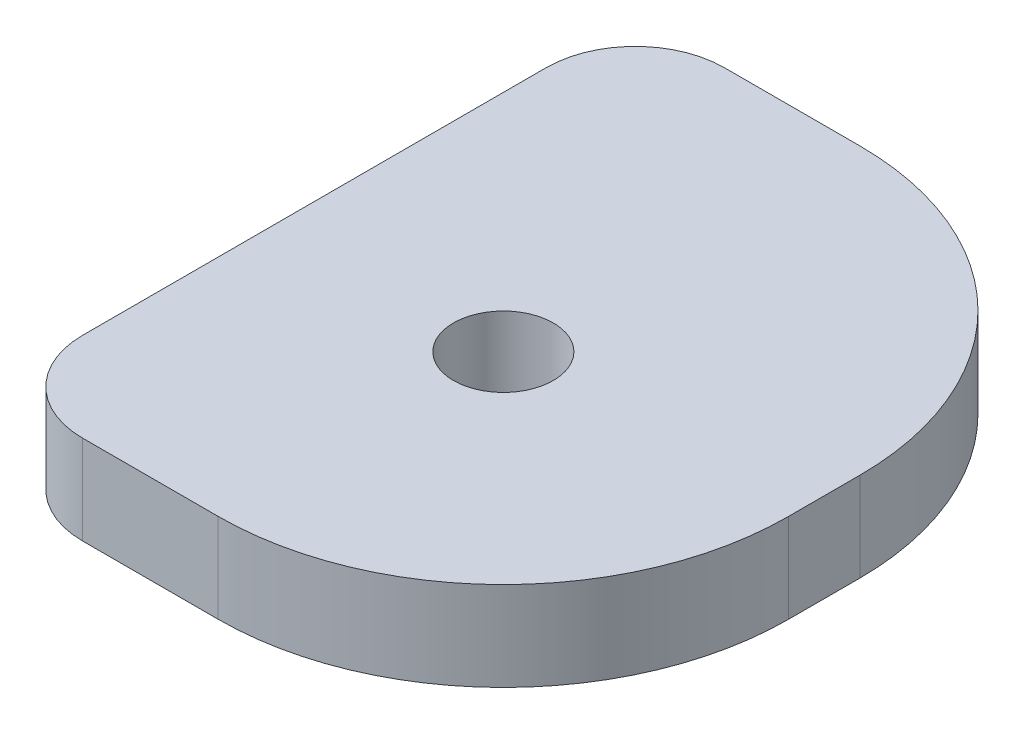
from build123d import *

# Parameters (mm, degrees)
SKETCH1_W           = 50.8
SKETCH1_H           = 22.86
BOSS_EXTRUDE1_DEPTH = 3.175
FILLET1_R           = 10.16
SKETCH3_R           = 1.778
CUT_EXTRUDE1_DEPTH  = 29.033649869
FILLET3_R           = 10.16
SKETCH4_W           = 32.639
SKETCH4_H           = 22.86
CUT_EXTRUDE2_DEPTH  = 29.033649869
FILLET9_R           = 3.175


with BuildPart() as part:
    # Sketch1 → Boss-Extrude1 (new body)
    with BuildSketch(Plane(origin=(0, 0, 0), x_dir=(1, 0, 0), z_dir=(0, 1, 0))):
        Rectangle(SKETCH1_W, SKETCH1_H)
    extrude(amount=BOSS_EXTRUDE1_DEPTH)

    # Fillet1
    fillet1_edges = [part.edges().sort_by_distance(p)[0] for p in [
        (25.4, 1.5875, 11.43),
        (-25.4, 1.5875, 11.43),
    ]]
    fillet(fillet1_edges, radius=FILLET1_R)

    # Sketch3 → Cut-Extrude1 (cut, through all)
    with BuildSketch(Plane(origin=(0, 3.175, 0), x_dir=(1, 0, 0), z_dir=(0, 1, 0))):
        with Locations(Location((15.24, -1.27, 0), (0, 0, 270))):
            Circle(SKETCH3_R)
        with Locations(Location((-3.81, -1.27, 0), (0, 0, 270))):
            Circle(SKETCH3_R)
    extrude(amount=-CUT_EXTRUDE1_DEPTH, mode=Mode.SUBTRACT)

    # Fillet3
    fillet3_edges = [part.edges().sort_by_distance(p)[0] for p in [
        (-25.4, 1.5875, -11.43),
        (25.4, 1.5875, -11.43),
    ]]
    fillet(fillet3_edges, radius=FILLET3_R)

    # Sketch4 → Cut-Extrude2 (cut, through all)
    with BuildSketch(Plane(origin=(0, 3.175, 0), x_dir=(1, 0, 0), z_dir=(0, 1, 0))):
        with Locations((-9.0805, 0)):
            Rectangle(SKETCH4_W, SKETCH4_H)
    extrude(amount=-CUT_EXTRUDE2_DEPTH, mode=Mode.SUBTRACT)

    # Fillet9
    fillet9_edges = [part.edges().sort_by_distance(p)[0] for p in [
        (7.239, 1.5875, -11.43),
        (7.239, 1.5875, 11.43),
    ]]
    fillet(fillet9_edges, radius=FILLET9_R)


solid = part.part
